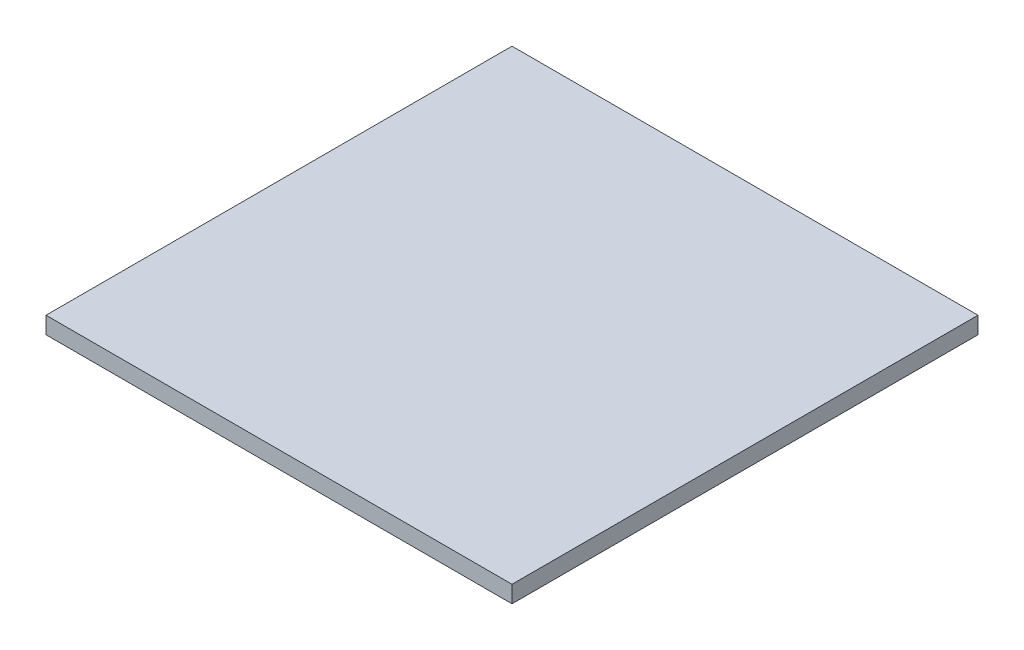
from build123d import *

# Parameters (mm, degrees)
SKETCH1_W           = 550
SKETCH1_H           = 550
BOSS_EXTRUDE1_DEPTH = 20


with BuildPart() as part:
    # Sketch1 → Boss-Extrude1 (new body)
    with BuildSketch(Plane(origin=(0, 0, 0), x_dir=(1, 0, 0), z_dir=(0, 1, 0))):
        Rectangle(SKETCH1_W, SKETCH1_H)
    extrude(amount=BOSS_EXTRUDE1_DEPTH)


solid = part.part
